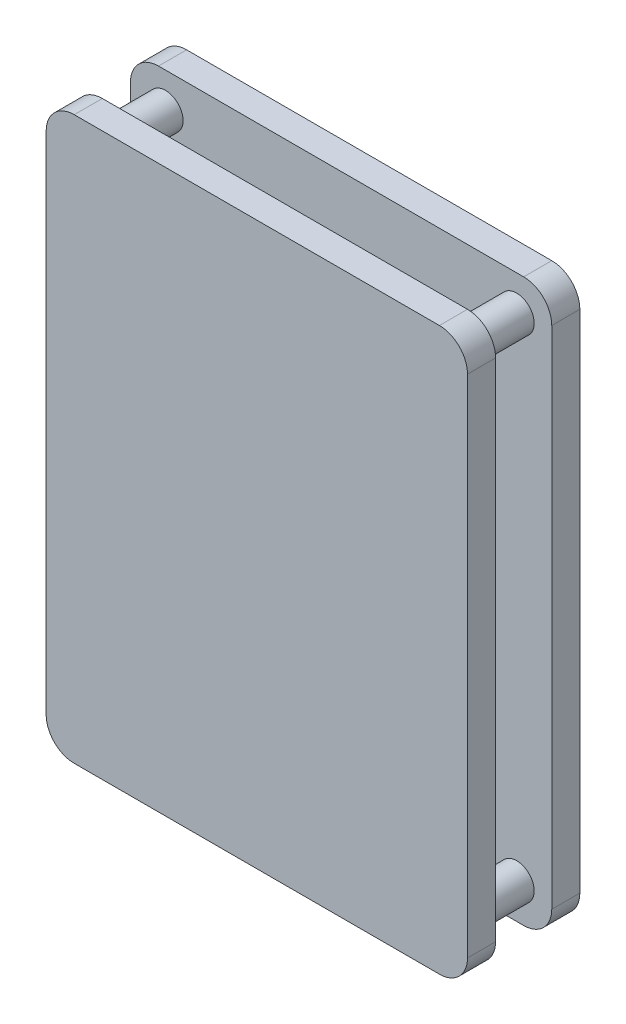
from build123d import *

# Parameters (mm, degrees)
SKETCH1_W           = 30
SKETCH1_H           = 40
BOSS_EXTRUDE1_DEPTH = 2
FILLET1_R           = 2
SKETCH2_R           = 1.25
BOSS_EXTRUDE2_DEPTH = 4
BOSS_EXTRUDE3_START = 2
BOSS_EXTRUDE3_DEPTH = 2


with BuildPart() as part:
    # Sketch1 → Boss-Extrude1 (new body)
    with BuildSketch(Plane.XY):
        with Locations((-68.585871194, -180)):
            Rectangle(SKETCH1_W, SKETCH1_H)
    extrude(amount=BOSS_EXTRUDE1_DEPTH)

    # Fillet1
    fillet1_edges = [part.edges().sort_by_distance(p)[0] for p in [
        (-83.585871194, -160, 1),
        (-53.585871194, -160, 1),
        (-53.585871194, -200, 1),
        (-83.585871194, -200, 1),
    ]]
    fillet(fillet1_edges, radius=FILLET1_R)

    # Sketch2 → Boss-Extrude2 (add)
    with BuildSketch(Plane.XY.offset(2)):
        with Locations((-81.085871194, -197.5)):
            Circle(SKETCH2_R)
        with Locations(Location((-56.085871194, -197.5, 0), (0, 0, 180))):
            Circle(SKETCH2_R)
        with Locations((-56.085871194, -162.5)):
            Circle(SKETCH2_R)
        with Locations(Location((-81.085871194, -162.5, 0), (0, 0, 180))):
            Circle(SKETCH2_R)
    extrude(amount=BOSS_EXTRUDE2_DEPTH)

    # Sketch3 → Boss-Extrude3 (add)
    with BuildSketch(Plane.XY.offset(6).offset(BOSS_EXTRUDE3_START)):
        with BuildLine():
            Line((-53.585871194, -198), (-53.585871194, -162))
            ThreePointArc((-53.585871194, -162), (-54.171657631, -160.585786438), (-55.585871194, -160))
            Line((-55.585871194, -160), (-81.585871194, -160))
            ThreePointArc((-81.585871194, -160), (-83.000084756, -160.585786438), (-83.585871194, -162))
            Line((-83.585871194, -162), (-83.585871194, -198))
            ThreePointArc((-83.585871194, -198), (-83.000084756, -199.414213562), (-81.585871194, -200))
            Line((-81.585871194, -200), (-55.585871194, -200))
            ThreePointArc((-55.585871194, -200), (-54.171657631, -199.414213562), (-53.585871194, -198))
        make_face()
    extrude(amount=-BOSS_EXTRUDE3_DEPTH)


solid = part.part
